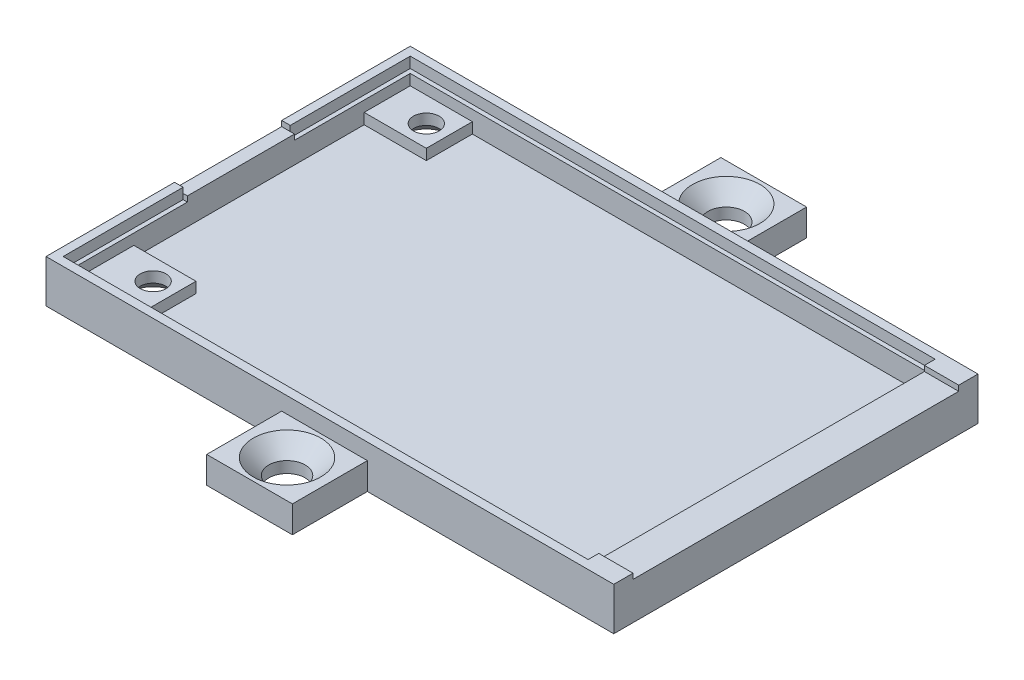
from build123d import *

# Parameters (mm, degrees)
SKETCH1_W                                           = 53
SKETCH1_H                                           = 34
BOSS_EXTRUDE1_DEPTH                                 = 4
SKETCH2_W                                           = 8
SKETCH2_H                                           = 7
BOSS_EXTRUDE2_DEPTH                                 = 2.5
SKETCH3_W                                           = 48.6
SKETCH3_H                                           = 31.6
CUT_EXTRUDE1_DEPTH                                  = 3
SKETCH4_W                                           = 5.8
SKETCH4_H                                           = 4.3
SKETCH4_H_2                                         = 5.8
BOSS_EXTRUDE3_DEPTH                                 = 1
CUT_EXTRUDE2_DEPTH                                  = 1
SKETCH6_W                                           = 1.2
SKETCH6_H                                           = 10
SKETCH6_W_2                                         = 3.2
SKETCH6_H_2                                         = 30.4
CUT_EXTRUDE3_DEPTH                                  = 0.5
CSK_FOR_M3_COUNTERSUNK_FLAT_HEAD_SCR_2_COUNT        = 2
CSK_FOR_M3_COUNTERSUNK_FLAT_HEAD_SCR_2_PITCH        = 41
CSK_FOR_M2_COUNTERSUNK_FLAT_HEAD_SCREW1_D           = 2.4
CSK_FOR_M2_COUNTERSUNK_FLAT_HEAD_SCREW1_CSINK_D     = 4.4
CSK_FOR_M2_COUNTERSUNK_FLAT_HEAD_SCREW1_CSINK_ANGLE = 90


with BuildPart() as part:
    # Sketch1 → Boss-Extrude1 (new body)
    with BuildSketch(Plane(origin=(0, 0, 0), x_dir=(1, 0, 0), z_dir=(0, 1, 0))):
        with Locations((26.5, 17)):
            Rectangle(SKETCH1_W, SKETCH1_H)
    extrude(amount=BOSS_EXTRUDE1_DEPTH)

    # Sketch2 → Boss-Extrude2 (add)
    with BuildSketch(Plane(origin=(0, 0, 0), x_dir=(1, 0, 0), z_dir=(0, 1, 0))):
        with Locations((26, -3.5)):
            Rectangle(SKETCH2_W, SKETCH2_H)
        with Locations((26, 37.5)):
            Rectangle(SKETCH2_W, SKETCH2_H)
    extrude(amount=BOSS_EXTRUDE2_DEPTH)

    # Sketch3 → Cut-Extrude1 (cut)
    with BuildSketch(Plane(origin=(0, 4, 0), x_dir=(1, 0, 0), z_dir=(0, 1, 0))):
        with Locations((25.5, 17)):
            Rectangle(SKETCH3_W, SKETCH3_H)
    extrude(amount=-CUT_EXTRUDE1_DEPTH, mode=Mode.SUBTRACT)

    # Sketch4 → Boss-Extrude3 (add)
    with BuildSketch(Plane(origin=(0, 1, 0), x_dir=(1, 0, 0), z_dir=(0, 1, 0))):
        with Locations((4.1, 30.65)):
            Rectangle(SKETCH4_W, SKETCH4_H)
        with Locations((4.1, 4.1)):
            Rectangle(SKETCH4_W, SKETCH4_H_2)
    extrude(amount=BOSS_EXTRUDE3_DEPTH)

    # Sketch5 → Cut-Extrude2 (cut)
    with BuildSketch(Plane(origin=(0, 4, 0), x_dir=(1, 0, 0), z_dir=(0, 1, 0))):
        Polygon((49.8, 32.8), (1.2, 32.8), (1.2, 22), (0.8, 22), (0.8, 33.2), (49.8, 33.2), align=None)
        Polygon((49.8, 1.2), (1.2, 1.2), (1.2, 12), (0.8, 12), (0.8, 0.8), (49.8, 0.8), align=None)
    extrude(amount=-CUT_EXTRUDE2_DEPTH, mode=Mode.SUBTRACT)

    # Sketch6 → Cut-Extrude3 (cut)
    with BuildSketch(Plane(origin=(0, 4, 0), x_dir=(1, 0, 0), z_dir=(0, 1, 0))):
        with Locations((0.6, 17)):
            Rectangle(SKETCH6_W, SKETCH6_H)
        with Locations((51.4, 17)):
            Rectangle(SKETCH6_W_2, SKETCH6_H_2)
    extrude(amount=-CUT_EXTRUDE3_DEPTH, mode=Mode.SUBTRACT)

    # Sketch8 → CSK for M3 Countersunk Flat Head Screw1 (revolve, cut)
    with BuildSketch(Plane(origin=(26, 2.5, -37.5), x_dir=(0, 0, 1), z_dir=(1, 0, 0))):
        Polygon((0, 0), (0, 2.5), (1.7, 2.5), (1.7, 1.45), (3.15, 0), align=None)
    csk_for_m3_countersunk_flat_head_screw1 = revolve(axis=Axis((26, 8.85, -37.5), (0, -1, 0)), mode=Mode.SUBTRACT)

    # CSK for M3 Countersunk Flat Head Scr 2: CSK for M3 Countersunk Flat Head Screw1 ×2
    with Locations(*[(0, 0, i * CSK_FOR_M3_COUNTERSUNK_FLAT_HEAD_SCR_2_PITCH) for i in range(1, CSK_FOR_M3_COUNTERSUNK_FLAT_HEAD_SCR_2_COUNT)]):
        add(csk_for_m3_countersunk_flat_head_screw1, mode=Mode.SUBTRACT)

    # CSK for M2 Countersunk Flat Head Screw1 (through all)
    with Locations(Plane(origin=(5, 0, -5), x_dir=(0, 0, -1), z_dir=(0, -1, 0))):
        with Locations((0, 0), (25.5, 0)):
            CounterSinkHole(CSK_FOR_M2_COUNTERSUNK_FLAT_HEAD_SCREW1_D / 2, CSK_FOR_M2_COUNTERSUNK_FLAT_HEAD_SCREW1_CSINK_D / 2, counter_sink_angle=CSK_FOR_M2_COUNTERSUNK_FLAT_HEAD_SCREW1_CSINK_ANGLE)


solid = part.part
